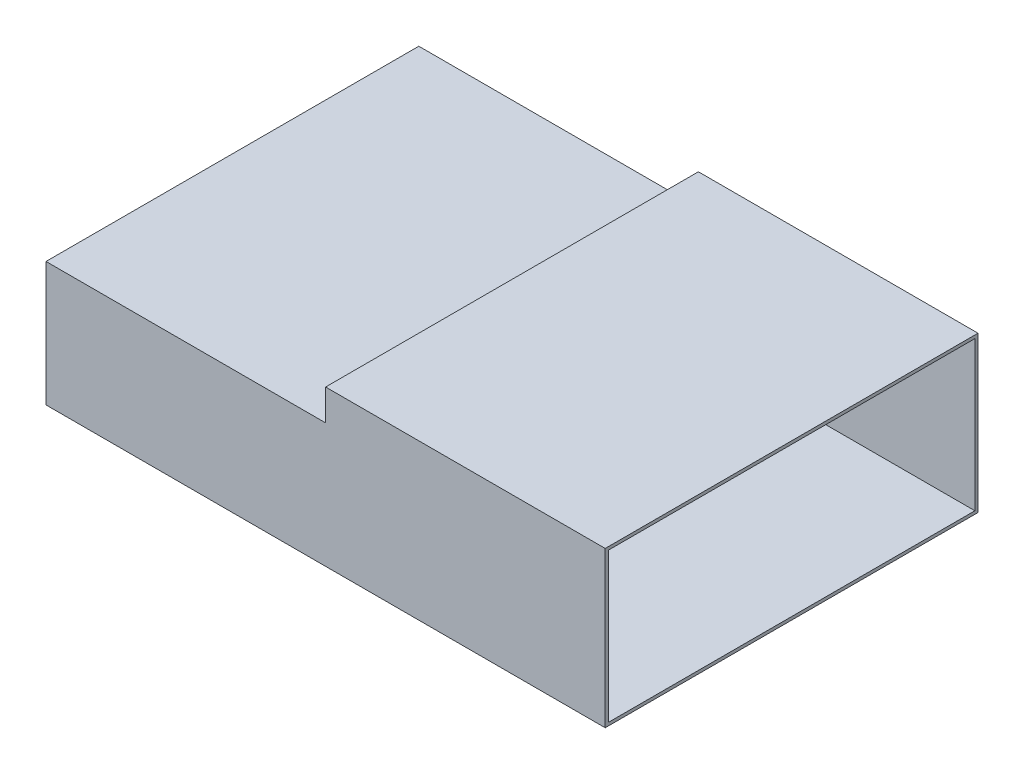
from build123d import *

# Parameters (mm, degrees)
SKETCH1_W           = 90
SKETCH1_H           = 60
BOSS_EXTRUDE2_DEPTH = 25
CUT_EXTRUDE1_START  = 25
SKETCH2_W           = 45
SKETCH2_H           = 60
CUT_EXTRUDE1_DEPTH  = 5
SKETCH4_W           = 59
SKETCH4_H           = 24
CUT_EXTRUDE3_DEPTH  = 44.5
CUT_EXTRUDE4_START  = -45.5
SKETCH5_W           = 59
SKETCH5_H           = 19
CUT_EXTRUDE4_DEPTH  = 45


with BuildPart() as part:
    # Sketch1 → Boss-Extrude2 (new body)
    with BuildSketch(Plane(origin=(0, 0, 0), x_dir=(1, 0, 0), z_dir=(0, 1, 0))):
        with Locations((6.260188088, 2.087774295)):
            Rectangle(SKETCH1_W, SKETCH1_H)
    extrude(amount=BOSS_EXTRUDE2_DEPTH)

    # Sketch2 → Cut-Extrude1 (cut)
    with BuildSketch(Plane(origin=(0, 0, 0), x_dir=(1, 0, 0), z_dir=(0, 1, 0)).offset(CUT_EXTRUDE1_START)):
        with Locations((-16.239811912, 2.087774295)):
            Rectangle(SKETCH2_W, SKETCH2_H)
    extrude(amount=-CUT_EXTRUDE1_DEPTH, mode=Mode.SUBTRACT)

    # Sketch4 → Cut-Extrude3 (cut)
    with BuildSketch(Plane(origin=(51.260188088, 0, 0), x_dir=(0, 0, -1), z_dir=(1, 0, 0))):
        with Locations((2.087774295, 12.5)):
            Rectangle(SKETCH4_W, SKETCH4_H)
    extrude(amount=-CUT_EXTRUDE3_DEPTH, mode=Mode.SUBTRACT)

    # Sketch5 → Cut-Extrude4 (cut)
    with BuildSketch(Plane.ZY.offset(38.739811912).offset(CUT_EXTRUDE4_START)):
        with Locations((-2.087774295, 10)):
            Rectangle(SKETCH5_W, SKETCH5_H)
    extrude(amount=CUT_EXTRUDE4_DEPTH, mode=Mode.SUBTRACT)


solid = part.part
